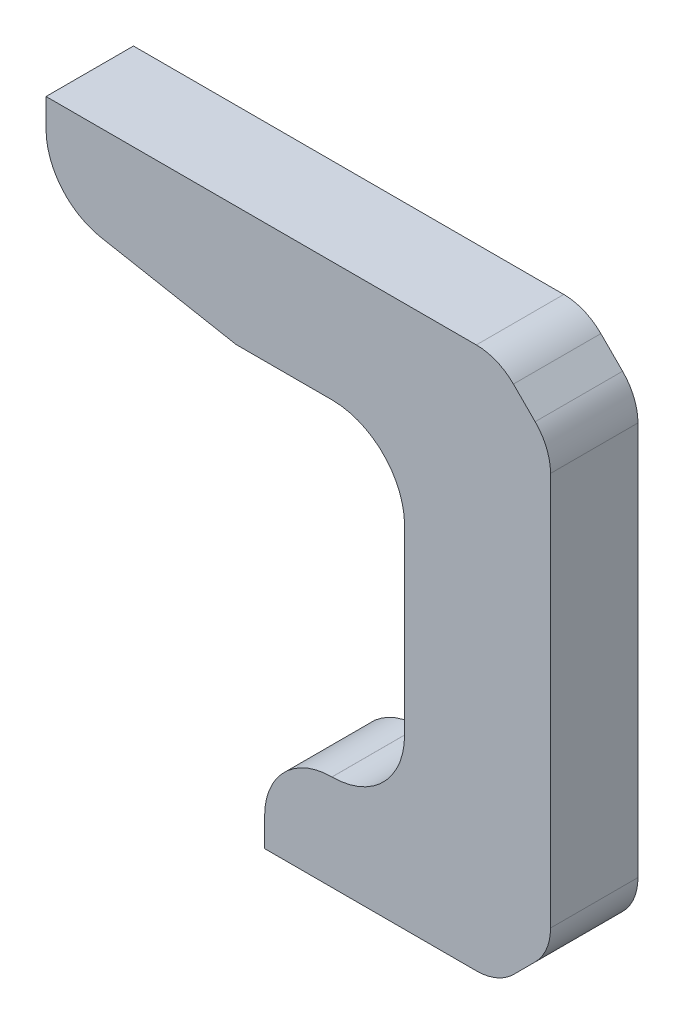
from build123d import *

# Parameters (mm, degrees)
RESSALTO_EXTRUS_O1_DEPTH = 10
CORTE_EXTRUS_O1_START    = -10
CORTE_EXTRUS_O1_DEPTH    = 8
FILETE1_R                = 3


with BuildPart() as part:
    # Esboço1 → Ressalto-extrusão1 (new body)
    with BuildSketch(Plane.XY):
        with BuildLine():
            Line((0, 8.485281374), (0, 53.514718626))
            ThreePointArc((0, 53.514718626), (-0.456722805, 55.81081922), (-1.757359313, 57.757359313))
            Line((-1.757359313, 57.757359313), (-4.242640687, 60.242640687))
            ThreePointArc((-4.242640687, 60.242640687), (-6.18918078, 61.543277195), (-8.485281374, 62))
            Line((-8.485281374, 62), (-57.7, 62))
            Line((-57.7, 62), (-57.7, 58.75))
            ThreePointArc((-57.7, 58.75), (-55.923006732, 53.82983829), (-51.412210065, 51.180610148))
            Line((-51.412210065, 51.180610148), (-35.972254096, 48.3))
            Line((-35.972254096, 48.3), (-24.993325909, 48.3))
            ThreePointArc((-24.993325909, 48.3), (-19.124339626, 45.868986284), (-16.693325909, 40))
            Line((-16.693325909, 40), (-16.693325909, 19.25))
            ThreePointArc((-16.693325909, 19.25), (-19.124339626, 13.381013716), (-24.993325909, 10.95))
            Line((-24.993325909, 10.95), (-25, 10.95))
            ThreePointArc((-25, 10.95), (-30.444722215, 8.694722215), (-32.7, 3.25))
            Line((-32.7, 3.25), (-32.7, 0))
            Line((-32.7, 0), (-8.485281374, 0))
            ThreePointArc((-8.485281374, 0), (-6.18918078, 0.456722805), (-4.242640687, 1.757359313))
            Line((-4.242640687, 1.757359313), (-1.757359313, 4.242640687))
            ThreePointArc((-1.757359313, 4.242640687), (-0.456722805, 6.18918078), (0, 8.485281374))
        make_face()
    extrude(amount=RESSALTO_EXTRUS_O1_DEPTH)

    # Esboço3 → Corte-extrusão1 (cut)
    with BuildSketch(Plane.XY.offset(10).offset(CORTE_EXTRUS_O1_START)):
        Polygon((-16.693325909, 41), (-12.193325909, 41), (-12.193325909, 21), (-16.693325909, 21), (-18.193325909, 21), (-18.193325909, 41), align=None)
    extrude(amount=CORTE_EXTRUS_O1_DEPTH, mode=Mode.SUBTRACT)

    # Filete1
    filete1_edges = [part.edges().sort_by_distance(p)[0] for p in [
        (-12.193325909, 21, 4),
        (-12.193325909, 41, 4),
    ]]
    fillet(filete1_edges, radius=FILETE1_R)


solid = part.part
